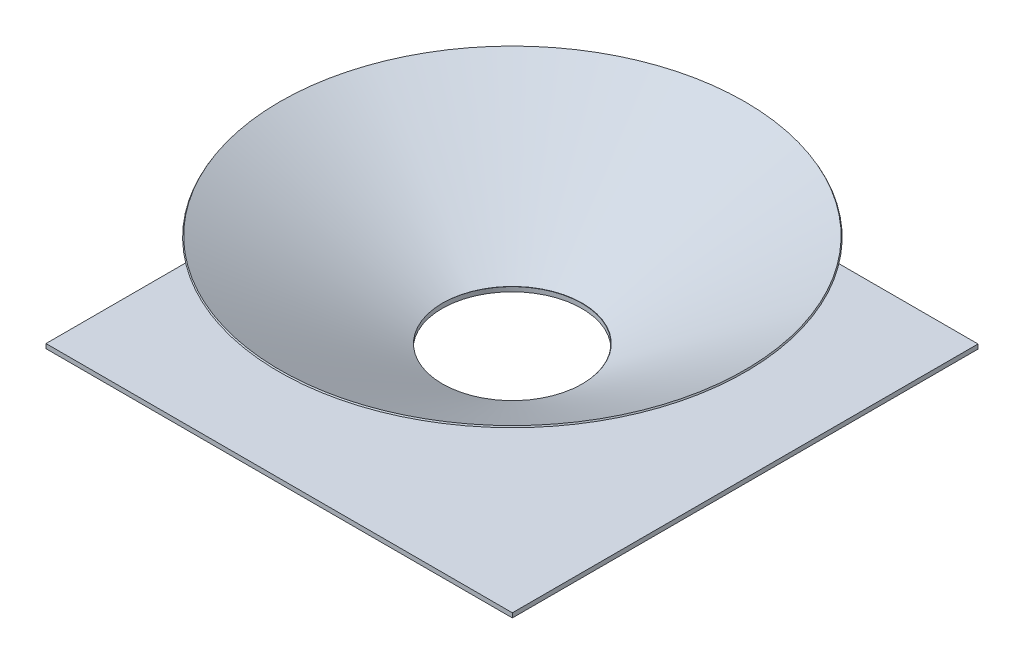
from build123d import *

# Parameters (mm, degrees)
SKETCH2_R           = 46.875
BOSS_EXTRUDE1_DEPTH = 3


with BuildPart() as part:
    # Sketch1 → Revolve1 (revolve)
    with BuildSketch(Plane.XY, mode=Mode.PRIVATE) as revolve1_sk:
        Polygon((-48.883652299488276, 0), (-156.25, 61.6327346895418), (-155.75215375739506, 62.5), (-46.875, 0), align=None)
    revolve(revolve1_sk.sketch.rotate(Axis((0, 0, 0), (0, 1, 0)), 90), axis=Axis((0, 0, 0), (0, 1, 0)))



with BuildPart() as body_2:
    # Sketch2 → Boss-Extrude1 (new body)
    with BuildSketch(Plane(origin=(0, 0, 0), x_dir=(1, 0, 0), z_dir=(0, 1, 0))):
        Polygon((-156.24999999999994, -156.25), (156.25000000000003, -156.25), (156.25, 155.75215375739506), (-156.24999999999994, 155.75215375739506), align=None)
        with Locations(Location((8.327e-14, -0.24892312130248007, 0), (0, 0, 270))):
            Circle(SKETCH2_R, mode=Mode.SUBTRACT)
    extrude(amount=-BOSS_EXTRUDE1_DEPTH)


with BuildPart() as part_1:
    add(part.part)

    add(body_2.part)  # Revolve2 merges body 2
    # Sketch3 → Revolve2 (revolve)
    with BuildSketch(Plane.XY, mode=Mode.PRIVATE) as revolve2_sk:
        with BuildLine():
            Line((-65.84427513417332, 9.73610064724726), (-48.88365229948828, 0))
            Line((-48.88365229948828, 0), (-68.44009325263127, 0))
            ThreePointArc((-68.44009325263127, 0), (-63.40199024858691, 3.8708478952321843), (-65.84427513417332, 9.73610064724726))
        make_face()
    revolve(revolve2_sk.sketch.rotate(Axis((0, 0, 0), (0, 1, 0)), 270), axis=Axis((0, 0, 0), (0, 1, 0)))


solid = part_1.part
